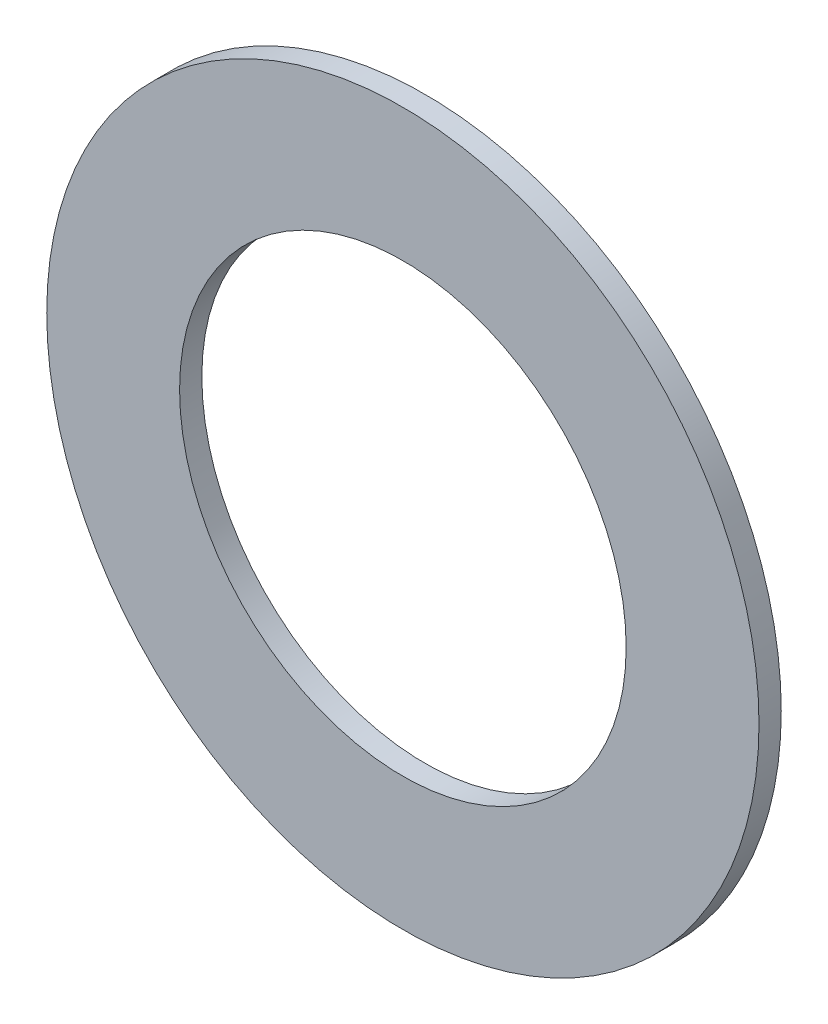
from build123d import *

# Parameters (mm, degrees)
SKETCH1_R      = 25.4
SKETCH1_R_2    = 15.9258
EXTRUDE1_DEPTH = 0.79375


with BuildPart() as part:
    # Sketch1 → Extrude1 (new, symmetric)
    with BuildSketch(Plane.XY):
        Circle(SKETCH1_R)
        Circle(SKETCH1_R_2, mode=Mode.SUBTRACT)
    extrude(amount=EXTRUDE1_DEPTH, both=True)


solid = part.part
